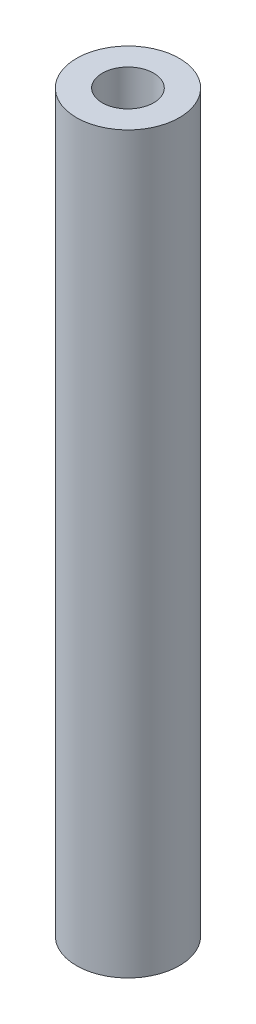
from build123d import *

# Parameters (mm, degrees)
SKETCH1_R           = 3.5
SKETCH1_R_2         = 1.75
BOSS_EXTRUDE1_DEPTH = 25


with BuildPart() as part:
    # Sketch1 → Boss-Extrude1 (new, symmetric)
    with BuildSketch(Plane(origin=(0, 0, 0), x_dir=(1, 0, 0), z_dir=(0, 1, 0))):
        with Locations(Location((0, 0, 0), (0, 0, 270))):
            Circle(SKETCH1_R)
        with Locations(Location((0, 0, 0), (0, 0, 270))):
            Circle(SKETCH1_R_2, mode=Mode.SUBTRACT)
    extrude(amount=BOSS_EXTRUDE1_DEPTH, both=True)


solid = part.part
